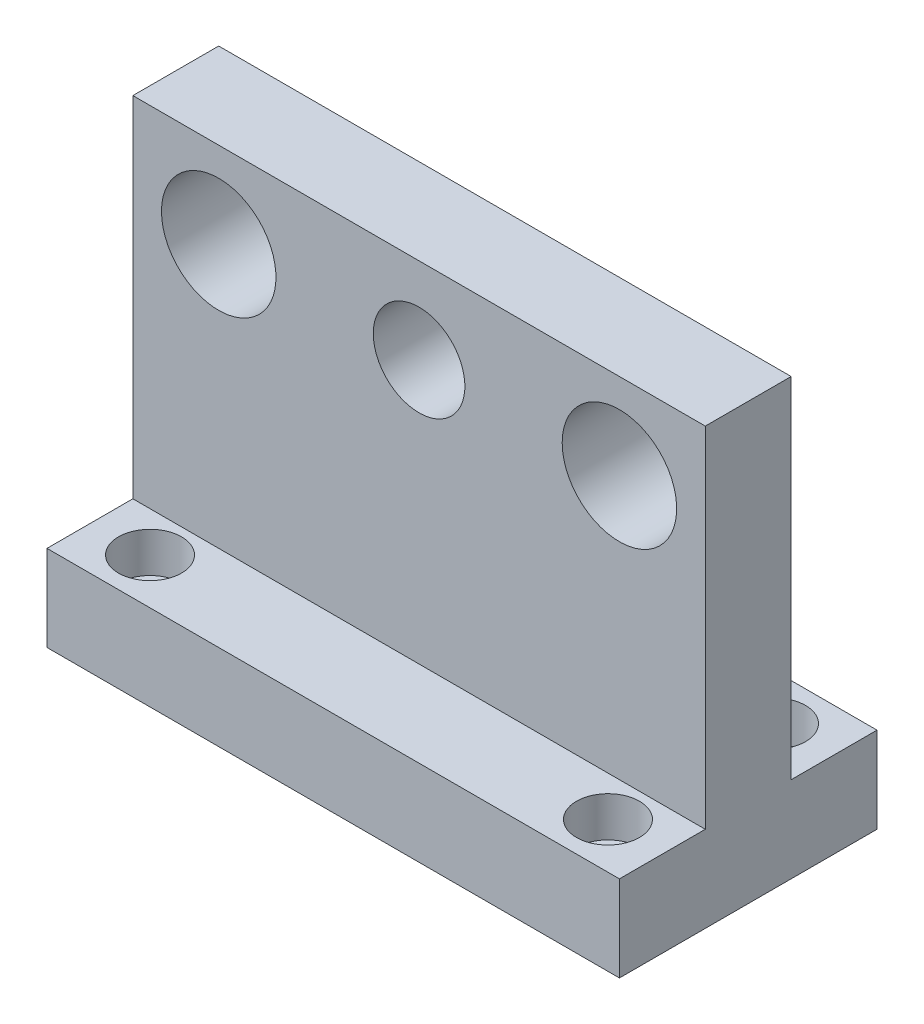
from build123d import *

# Parameters (mm, degrees)
SKETCH_1_W          = 100
SKETCH_1_H          = 61
EXTRUDE_1_DEPTH     = 15
SKETCH_2_W          = 100
SKETCH_2_H          = 45
EXTRUDE_2_DEPTH     = 15
SKETCH_3_R          = 3.5
CUT_EXTRUDE_1_DEPTH = 121.917327129
SKETCH_4_R          = 5.5
CUT_EXTRUDE_2_DEPTH = 7
SKETCH_5_R          = 10
SKETCH_5_R_2        = 8
CUT_EXTRUDE_3_DEPTH = 121.917327129


with BuildPart() as part:
    # 草图1 → 凸台-拉伸1 (new body)
    with BuildSketch(Plane.XY):
        with Locations((50, 30.5)):
            Rectangle(SKETCH_1_W, SKETCH_1_H)
    extrude(amount=EXTRUDE_1_DEPTH)

    # 草图2 → 凸台-拉伸2 (add)
    with BuildSketch(Plane.XZ):
        with Locations((50, 7.5)):
            Rectangle(SKETCH_2_W, SKETCH_2_H)
    extrude(amount=EXTRUDE_2_DEPTH)

    # 草图3 → 切除-拉伸1 (cut, through all)
    with BuildSketch(Plane(origin=(0, 0, 0), x_dir=(1, 0, 0), z_dir=(0, 1, 0))):
        with Locations(Location((10, 7, 0), (0, 0, 270))):
            Circle(SKETCH_3_R)
        with Locations(Location((90, 7, 0), (0, 0, 270))):
            Circle(SKETCH_3_R)
        with Locations(Location((90, -22, 0), (0, 0, 90))):
            Circle(SKETCH_3_R)
        with Locations(Location((10, -22, 0), (0, 0, 90))):
            Circle(SKETCH_3_R)
    extrude(amount=-CUT_EXTRUDE_1_DEPTH, mode=Mode.SUBTRACT)

    # 草图4 → 切除-拉伸2 (cut)
    with BuildSketch(Plane(origin=(0, 0, 0), x_dir=(1, 0, 0), z_dir=(0, 1, 0))):
        with Locations(Location((10, 7, 0), (0, 0, 270))):
            Circle(SKETCH_4_R)
        with Locations(Location((90, 7, 0), (0, 0, 270))):
            Circle(SKETCH_4_R)
        with Locations(Location((10, -22, 0), (0, 0, 270))):
            Circle(SKETCH_4_R)
        with Locations(Location((90, -22, 0), (0, 0, 270))):
            Circle(SKETCH_4_R)
    extrude(amount=-CUT_EXTRUDE_2_DEPTH, mode=Mode.SUBTRACT)

    # 草图5 → 切除-拉伸3 (cut, through all)
    with BuildSketch(Plane(origin=(0, 0, 0), x_dir=(-1, 0, 0), z_dir=(0, 0, -1))):
        with Locations((-85, 46)):
            Circle(SKETCH_5_R)
        with Locations((-15, 46)):
            Circle(SKETCH_5_R)
        with Locations((-50, 46)):
            Circle(SKETCH_5_R_2)
    extrude(amount=-CUT_EXTRUDE_3_DEPTH, mode=Mode.SUBTRACT)


solid = part.part
